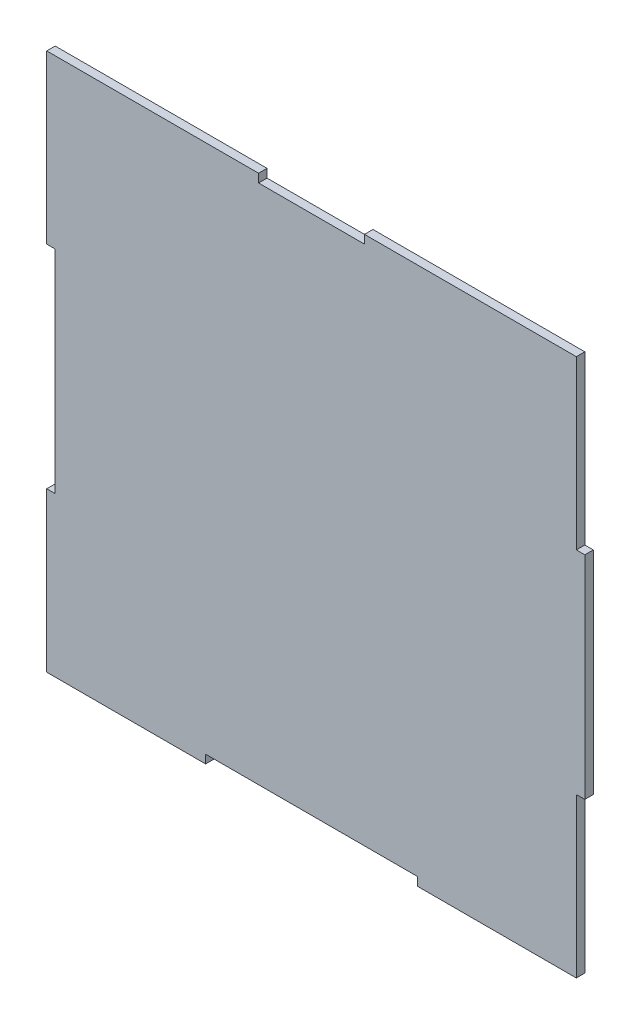
from build123d import *

# Parameters (mm, degrees)
BOSS_EXTRUDE1_DEPTH = 4


with BuildPart() as part:
    # Sketch1 → Boss-Extrude1 (new body)
    with BuildSketch(Plane.XY):
        Polygon((-2.181520688, -124.727718968), (-2.181520688, -49.727718968), (1.818479312, -49.727718968), (1.818479312, 50.272281032), (-2.181520688, 50.272281032), (-2.181520688, 125.272281032), (-2.181520688, 129.272281032), (-102.181520688, 129.272281032), (-102.181520688, 125.272281032), (-152.181520688, 125.272281032), (-152.181520688, 129.272281032), (-252.181520688, 129.272281032), (-252.181520688, 125.272281032), (-252.181520688, 50.272281032), (-248.181520688, 50.272281032), (-248.181520688, -49.727718968), (-252.181520688, -49.727718968), (-252.181520688, -124.727718968), (-177.181520688, -124.727718968), (-177.181520688, -120.727718968), (-77.181520688, -120.727718968), (-77.181520688, -124.727718968), align=None)
    extrude(amount=BOSS_EXTRUDE1_DEPTH)


solid = part.part
